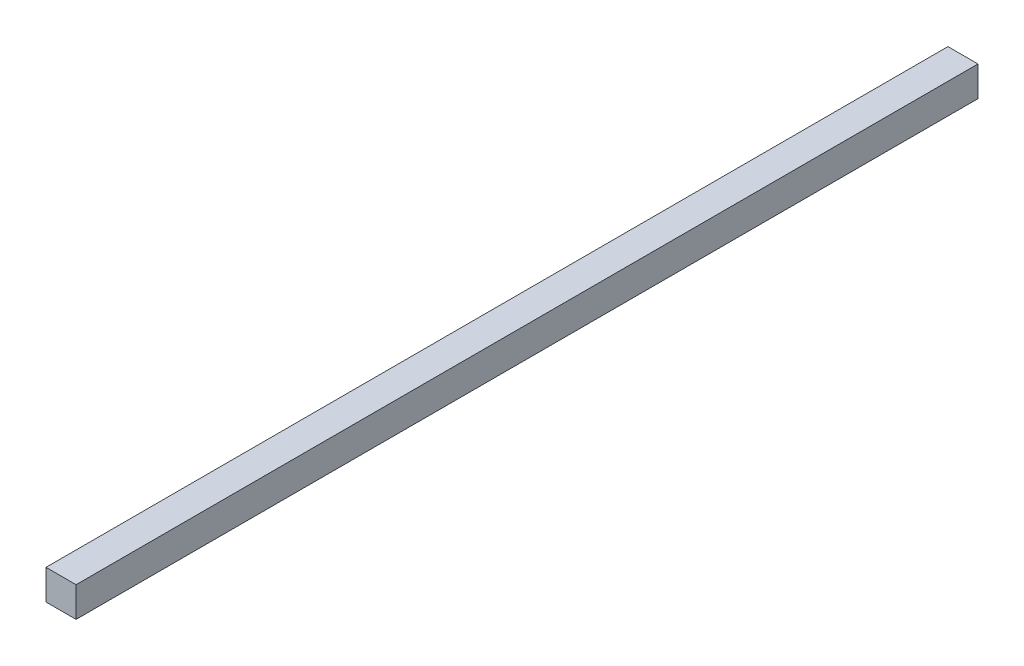
from build123d import *

# Parameters (mm, degrees)
SKETCH1_W           = 20
SKETCH1_H           = 20
BOSS_EXTRUDE1_DEPTH = 600


with BuildPart() as part:
    # Sketch1 → Boss-Extrude1 (new body)
    with BuildSketch(Plane.XY):
        with Locations((10, -10)):
            Rectangle(SKETCH1_W, SKETCH1_H)
    extrude(amount=BOSS_EXTRUDE1_DEPTH)


solid = part.part
